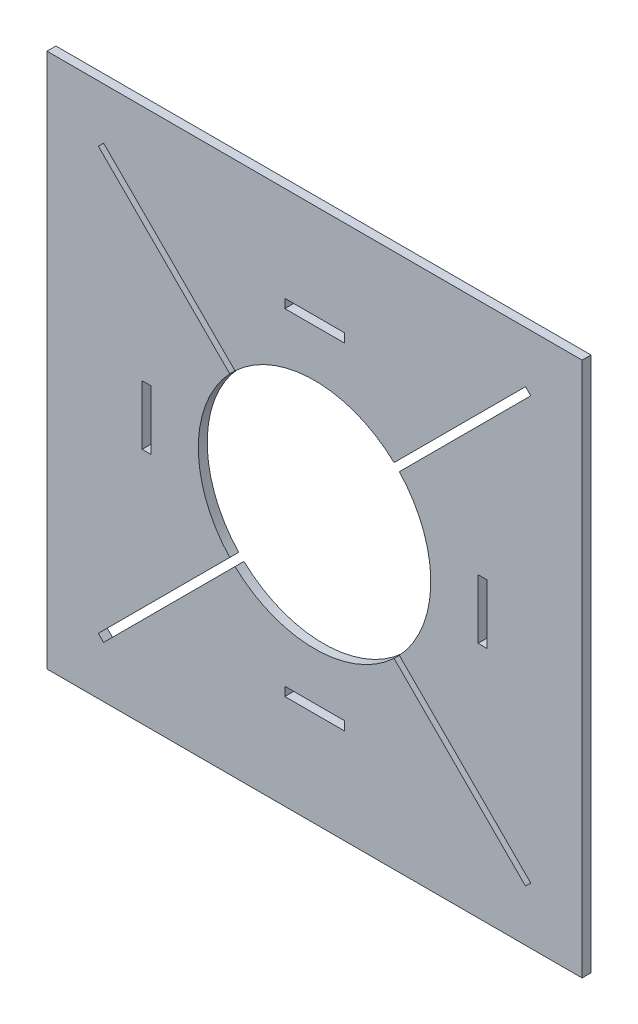
from build123d import *

# Parameters (mm, degrees)
SKETCH1_W           = 360
SKETCH1_H           = 360
BOSS_EXTRUDE1_DEPTH = 6
SKETCH2_R           = 78.2
CUT_EXTRUDE1_DEPTH  = 255.629142087
CUT_EXTRUDE2_DEPTH  = 255.629142087
CIRPATTERN1_COUNT   = 4
SKETCH4_W           = 40
SKETCH4_H           = 6
CUT_EXTRUDE3_DEPTH  = 255.629142087
CIRPATTERN2_COUNT   = 4


with BuildPart() as part:
    # Sketch1 → Boss-Extrude1 (new body)
    with BuildSketch(Plane.XY):
        Rectangle(SKETCH1_W, SKETCH1_H)
    extrude(amount=BOSS_EXTRUDE1_DEPTH)

    # Sketch2 → Cut-Extrude1 (cut, through all)
    with BuildSketch(Plane.XY.offset(6)):
        Circle(SKETCH2_R)
    extrude(amount=-CUT_EXTRUDE1_DEPTH, mode=Mode.SUBTRACT)

    # Sketch3 → Cut-Extrude2 (cut, through all)
    with BuildSketch(Plane.XY.offset(6)):
        with BuildLine():
            Line((-57.035252874, 53.499718968), (-145.45186489, 141.916330984))
            Line((-145.45186489, 141.916330984), (-141.916330984, 145.45186489))
            Line((-141.916330984, 145.45186489), (-53.499718968, 57.035252874))
            ThreePointArc((-53.499718968, 57.035252874), (-55.295750289, 55.295750289), (-57.035252874, 53.499718968))
        make_face()
    cut_extrude2 = extrude(amount=-CUT_EXTRUDE2_DEPTH, mode=Mode.SUBTRACT)

    # CirPattern1: Cut-Extrude2 ×4 about axis
    cirpattern1_axis = Axis((0, 0, -0.3), (0, 0, 1))
    for i in range(1, CIRPATTERN1_COUNT):
        add(cut_extrude2.rotate(cirpattern1_axis, i * 360 / CIRPATTERN1_COUNT), mode=Mode.SUBTRACT)

    # Sketch4 → Cut-Extrude3 (cut, through all)
    with BuildSketch(Plane.XY.offset(6)):
        with Locations((0, 113)):
            Rectangle(SKETCH4_W, SKETCH4_H)
    cut_extrude3 = extrude(amount=-CUT_EXTRUDE3_DEPTH, mode=Mode.SUBTRACT)

    # CirPattern2: Cut-Extrude3 ×4 about axis
    cirpattern2_axis = Axis((0, 0, -0.3), (0, 0, 1))
    for i in range(1, CIRPATTERN2_COUNT):
        add(cut_extrude3.rotate(cirpattern2_axis, i * 360 / CIRPATTERN2_COUNT), mode=Mode.SUBTRACT)


solid = part.part
